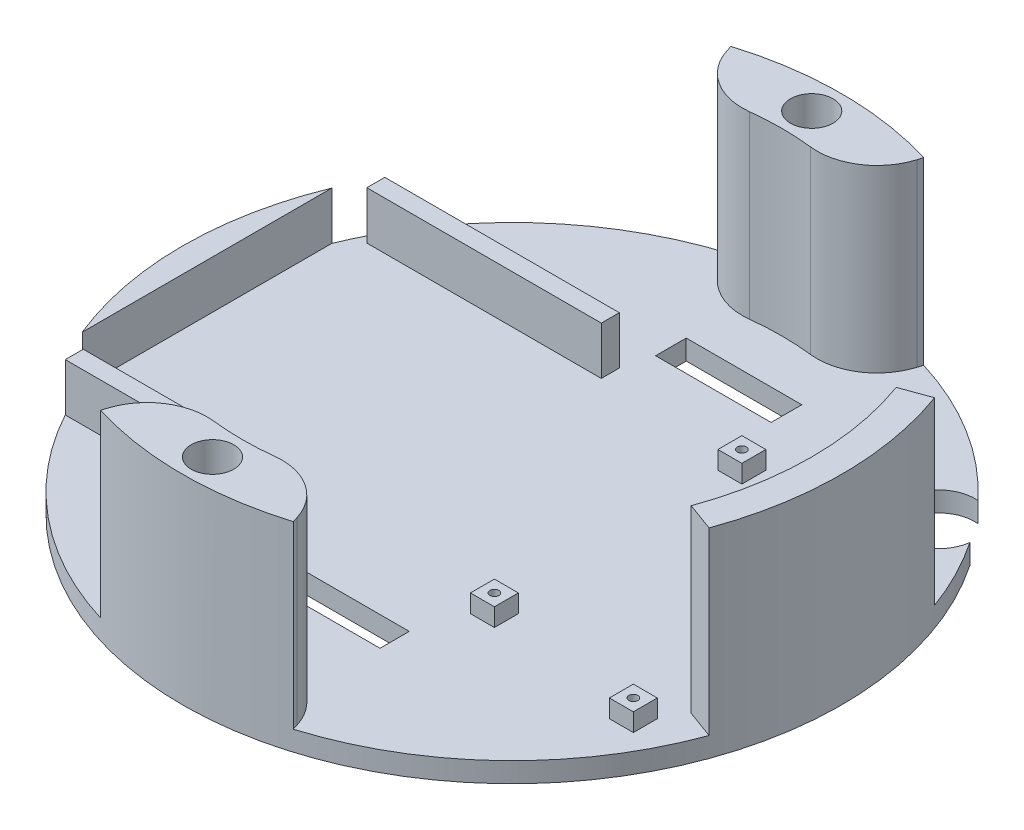
from build123d import *
from build123d.topology import SkipClean

# Parameters (mm, degrees)
SKETCH2_R               = 69.85
BOSS_EXTRUDE1_DEPTH     = 4.233333
BOSS_EXTRUDE2_DEPTH     = 38.1
FILLET3_R               = 12.7
FILLET4_R               = 12.7
FILLET5_R               = 12.7
BOSS_EXTRUDE3_DEPTH     = 38.1
CUT_EXTRUDE1_DEPTH      = 108.471653
CUT_EXTRUDE1_DEPTH_BACK = 108.471653
SKETCH5_R               = 4.5085
FILLET6_R               = 12.7
SKETCH7_W               = 5.08
SKETCH7_H               = 5.08
SKETCH7_R               = 0.95
SKETCH7_W_2             = 5.21946
SKETCH7_H_2             = 5.21946
BOSS_EXTRUDE4_DEPTH     = 3.81
SKETCH8_W               = 39.395172
SKETCH8_H               = 3.81
SKETCH8_W_2             = 49.68876
BOSS_EXTRUDE5_DEPTH     = 10.16
CUT_EXTRUDE2_DEPTH      = 105.565047
CUT_EXTRUDE2_DEPTH_BACK = 105.565047
SKETCH9_R               = 0.95
SKETCH9_R_2             = 7.62
SKETCH9_W               = 34.817305
SKETCH9_H               = 6.189743
SKETCH9_W_2             = 24.487021
SKETCH9_H_2             = 6.502021


with BuildPart() as part:
    # Sketch2 → Boss-Extrude1 (new body)
    with BuildSketch(Plane(origin=(0, 0, 0), x_dir=(1, 0, 0), z_dir=(0, 1, 0))):
        with Locations(Location((0, 0, 0), (0, 0, 270))):
            Circle(SKETCH2_R)
    extrude(amount=BOSS_EXTRUDE1_DEPTH)

    # Sketch3 → Boss-Extrude2 (add)
    with BuildSketch(Plane(origin=(0, 4.233333, 0), x_dir=(1, 0, 0), z_dir=(0, 1, 0))):
        with BuildLine():
            Line((-16.709043, -54.652817), (-20.422164, -66.797887))
            ThreePointArc((-20.422164, -66.797887), (0, -69.85), (20.422164, -66.797887))
            Line((20.422164, -66.797887), (16.709043, -54.652817))
            ThreePointArc((16.709043, -54.652817), (0, -57.15), (-16.709043, -54.652817))
        make_face()
        with BuildLine():
            ThreePointArc((20.422164, 66.797887), (0, 69.85), (-20.422164, 66.797887))
            Line((-20.422164, 66.797887), (-16.709043, 54.652817))
            ThreePointArc((-16.709043, 54.652817), (0, 57.15), (16.709043, 54.652817))
            Line((16.709043, 54.652817), (20.422164, 66.797887))
        make_face()
    extrude(amount=BOSS_EXTRUDE2_DEPTH)

    # Fillet3
    fillet3_edges = [part.edges().sort_by_distance(p)[0] for p in [
        (-16.709043, 23.283333, -54.652817),
    ]]
    fillet(fillet3_edges, radius=FILLET3_R)

    # Fillet4
    fillet4_edges = [part.edges().sort_by_distance(p)[0] for p in [
        (16.709043, 23.283333, 54.652817),
    ]]
    fillet(fillet4_edges, radius=FILLET4_R)

    # Fillet5
    fillet5_edges = [part.edges().sort_by_distance(p)[0] for p in [
        (-16.709043, 23.283333, 54.652817),
    ]]
    fillet(fillet5_edges, radius=FILLET5_R)

    # Sketch4 → Boss-Extrude3 (add)
    with SkipClean():  # the faces are left unmerged after this step: merging them gives an invalid solid
        with BuildSketch(Plane(origin=(0, 4.233333, 0), x_dir=(1, 0, 0), z_dir=(0, 1, 0))):
            with BuildLine():
                Line((59.670481, 21.718279), (65.63753, 23.890107))
                ThreePointArc((65.63753, 23.890107), (69.85, 0), (65.63753, -23.890107))
                Line((65.63753, -23.890107), (59.670481, -21.718279))
                ThreePointArc((59.670481, -21.718279), (63.5, 0), (59.670481, 21.718279))
            make_face()
        extrude(amount=BOSS_EXTRUDE3_DEPTH)

    # Sketch5 → Cut-Extrude1 (cut, two sides: drawn at the far end of the back side and taken through both)
    with SkipClean():  # the faces are left unmerged after this step: merging them gives an invalid solid
        with BuildSketch(Plane(origin=(0, 42.333333, 0), x_dir=(1, 0, 0), z_dir=(0, 1, 0)).offset(-CUT_EXTRUDE1_DEPTH_BACK)):
            with Locations(Location((0, 63.5, 0), (0, 0, 270))):
                Circle(SKETCH5_R)
            with Locations(Location((0, -63.5, 0), (0, 0, 270))):
                Circle(SKETCH5_R)
        extrude(amount=CUT_EXTRUDE1_DEPTH + CUT_EXTRUDE1_DEPTH_BACK, mode=Mode.SUBTRACT)

    # Fillet6
    fillet6_edges = [part.edges().sort_by_distance(p)[0] for p in [
        (16.709043, 23.283333, -54.652817),
    ]]
    fillet(fillet6_edges, radius=FILLET6_R)

    # Sketch7 → Boss-Extrude4 (add)
    # profile 1 of 4: a face of its own
    with SkipClean():  # the faces are left unmerged after this step: merging them gives an invalid solid
        with BuildSketch(Plane(origin=(0, 4.233333, 0), x_dir=(1, 0, 0), z_dir=(0, 1, 0))):
            with Locations((54.53008, -28.83611)):
                Rectangle(SKETCH7_W, SKETCH7_H)
            with Locations(Location((54.53008, -28.83611, 0), (0, 0, 90))):
                Circle(SKETCH7_R, mode=Mode.SUBTRACT)
        # profile 2 of 4: a face of its own
        with BuildSketch(Plane(origin=(0, 4.233333, 0), x_dir=(1, 0, 0), z_dir=(0, 1, 0))):
            with Locations((20.53008, -24.28611)):
                Rectangle(SKETCH7_W, SKETCH7_H)
            with Locations(Location((20.53008, -24.28611, 0), (0, 0, 90))):
                Circle(SKETCH7_R, mode=Mode.SUBTRACT)
        # profile 3 of 4: a face of its own
        with BuildSketch(Plane(origin=(0, 4.233333, 0), x_dir=(1, 0, 0), z_dir=(0, 1, 0))):
            with Locations((20.43008, 28.26389)):
                Rectangle(SKETCH7_W, SKETCH7_H)
            with Locations(Location((20.43008, 28.26389, 0), (0, 0, 90))):
                Circle(SKETCH7_R, mode=Mode.SUBTRACT)
        # profile 4 of 4: a face of its own
        with BuildSketch(Plane(origin=(0, 4.233333, 0), x_dir=(1, 0, 0), z_dir=(0, 1, 0))):
            with Locations((43.18086, 28.26389)):
                Rectangle(SKETCH7_W_2, SKETCH7_H_2)
            with Locations(Location((43.18086, 28.26389, 0), (0, 0, 90))):
                Circle(SKETCH7_R, mode=Mode.SUBTRACT)
        extrude(amount=BOSS_EXTRUDE4_DEPTH)

    # Sketch8 → Boss-Extrude5 (add)
    with SkipClean():  # the faces are left unmerged after this step: merging them gives an invalid solid
        with BuildSketch(Plane(origin=(0, 4.233333, 0), x_dir=(1, 0, 0), z_dir=(0, 1, 0))):
            with BuildLine():
                Line((-64.653219, 26.438301), (-64.653219, -26.438301))
                ThreePointArc((-64.653219, -26.438301), (-69.85, 0), (-64.653219, 26.438301))
            make_face()
            with Locations((-41.712592, -31.378818)):
                Rectangle(SKETCH8_W, SKETCH8_H)
            with Locations((-36.157599, 32.121182)):
                Rectangle(SKETCH8_W_2, SKETCH8_H)
        extrude(amount=BOSS_EXTRUDE5_DEPTH)

    # Sketch9 → Cut-Extrude2 (cut, two sides: drawn at the far end of the back side and taken through both)
    with BuildSketch(Plane(origin=(0, 8.043333, 0), x_dir=(1, 0, 0), z_dir=(0, 1, 0)).offset(-CUT_EXTRUDE2_DEPTH_BACK)):
        with Locations(Location((20.43008, 28.26389, 0), (0, 0, 90))):
            Circle(SKETCH9_R)
        with Locations(Location((43.18086, 28.26389, 0), (0, 0, 90))):
            Circle(SKETCH9_R)
        with Locations(Location((20.53008, -24.28611, 0), (0, 0, 90))):
            Circle(SKETCH9_R)
        with Locations(Location((54.53008, -28.83611, 0), (0, 0, 90))):
            Circle(SKETCH9_R)
        with Locations((50.292, 40.132)):
            Circle(SKETCH9_R_2)
        with Locations((-2.651495, -39.653042)):
            Rectangle(SKETCH9_W, SKETCH9_H)
        with Locations((2.513647, 43.38301)):
            Rectangle(SKETCH9_W_2, SKETCH9_H_2)
    extrude(amount=CUT_EXTRUDE2_DEPTH + CUT_EXTRUDE2_DEPTH_BACK, mode=Mode.SUBTRACT)


solid = part.part
